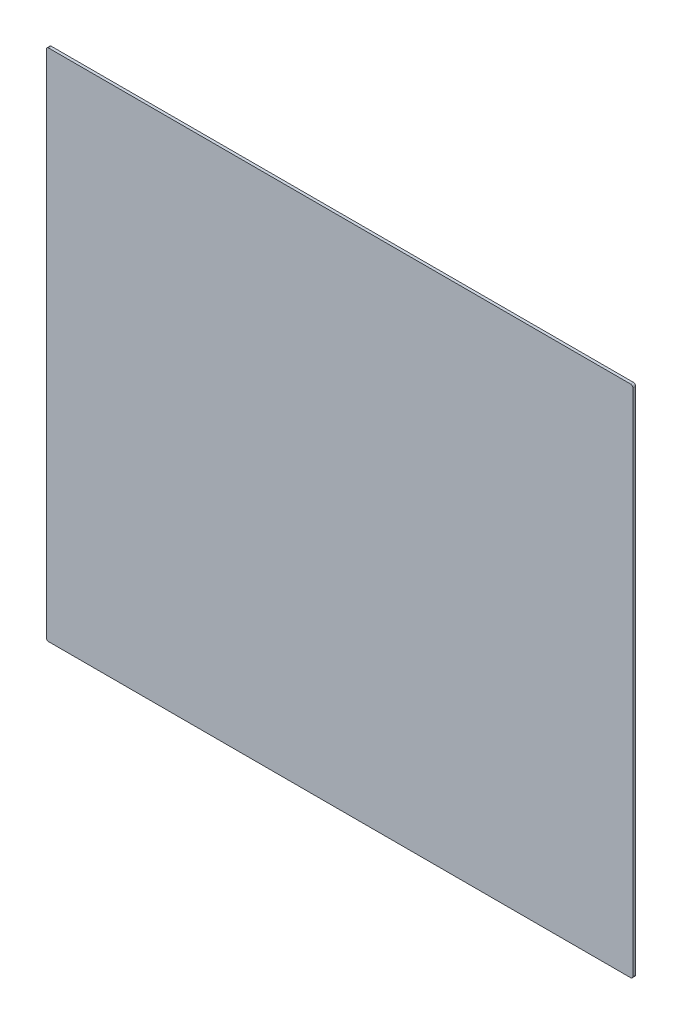
from build123d import *

# Parameters (mm, degrees)
SKETCH1_W           = 647.7
SKETCH1_H           = 567.69
BOSS_EXTRUDE1_DEPTH = 3.175
FILLET1_R           = 2.54


with BuildPart() as part:
    # Sketch1 → Boss-Extrude1 (new body)
    with BuildSketch(Plane.XY):
        with Locations((98.873295573, -23.118597285)):
            Rectangle(SKETCH1_W, SKETCH1_H)
    extrude(amount=BOSS_EXTRUDE1_DEPTH)

    # Fillet1
    fillet1_edges = [part.edges().sort_by_distance(p)[0] for p in [
        (-224.976704427, 260.726402715, 1.5875),
        (-224.976704427, -306.963597285, 1.5875),
        (422.723295573, -306.963597285, 1.5875),
        (422.723295573, 260.726402715, 1.5875),
    ]]
    fillet(fillet1_edges, radius=FILLET1_R)


solid = part.part
